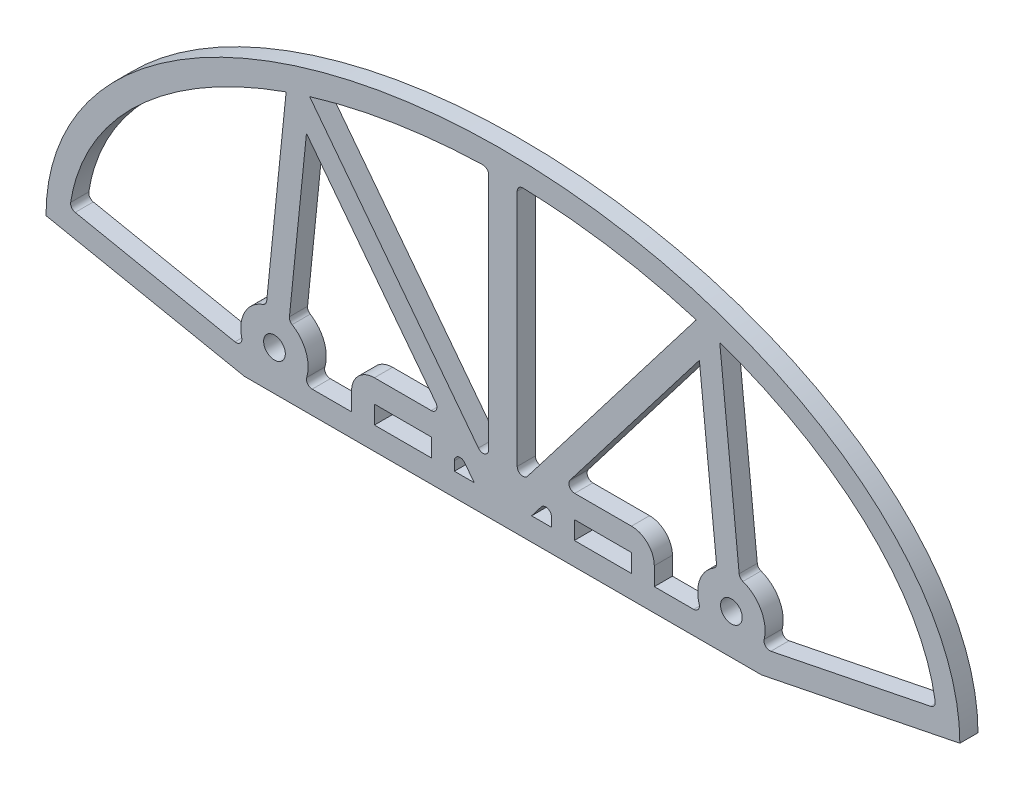
from build123d import *

# Parameters (mm, degrees)
SKETCH3_R           = 1.9
SKETCH3_W           = 10
SKETCH3_H           = 3.175
BOSS_EXTRUDE1_DEPTH = 3.175
CUT_EXTRUDE2_DEPTH  = 3.175
FILLET1_R           = 1


with BuildPart() as part:
    # Sketch3 → Boss-Extrude1 (new body)
    with BuildSketch(Plane.XY):
        with BuildLine():
            Line((-40, 22.2), (-5.265913382, 15.2))
            Line((-5.265913382, 15.2), (85.265913382, 15.2))
            Line((85.265913382, 15.2), (120, 22.2))
            add(Edge.make_bspline(
                [(120, 22.2), (120, 72.2), (40, 72.2), (-40, 72.2), (-40, 22.2)],
                knots=[3.141592654, 3.141592654, 3.141592654, 4.71238898, 4.71238898, 6.283185307, 6.283185307, 6.283185307], degree=2, weights=[1, 0.707106781, 1, 0.707106781, 1]))
        make_face()
        with Locations((80, 22.2)):
            Circle(SKETCH3_R, mode=Mode.SUBTRACT)
        with Locations((0, 22.2)):
            Circle(SKETCH3_R, mode=Mode.SUBTRACT)
        with Locations((57.5, 20.7875)):
            Rectangle(SKETCH3_W, SKETCH3_H, mode=Mode.SUBTRACT)
        with Locations((22.5, 20.7875)):
            Rectangle(SKETCH3_W, SKETCH3_H, mode=Mode.SUBTRACT)
    extrude(amount=BOSS_EXTRUDE1_DEPTH)

    # Sketch4 → Cut-Extrude2 (cut)
    with BuildSketch(Plane.XY.offset(3.175)):
        with BuildLine():
            add(Edge.make_bspline(
                [(2.040893372, 61.982357124), (2.034052922, 61.979946823), (-3.206137681, 60.132850009), (-11.950990438, 56.135783135), (-22.176984942, 48.964684289), (-29.333828942, 41.516537507), (-33.241172174, 34.903291209), (-35.119628904, 29.501109788), (-35.644509516, 26.807089313), (-35.807708322, 25.435543842)],
                knots=[5.225747329, 5.225747329, 5.225747329, 5.225747329, 5.226053967, 5.460671409, 5.647742016, 5.834812623, 6.02188323, 6.115418534, 6.208953837, 6.208953837, 6.208953837, 6.208953837], degree=3))
            Line((-35.807708322, 25.435543842), (-5.108836853, 19.248765342))
            ThreePointArc((-5.108836853, 19.248765342), (-5.431262295, 24.504645284), (-1.427364793, 27.9247384))
            Line((-1.427364793, 27.9247384), (2.040893372, 61.982357124))
        make_face()
        with BuildLine():
            Line((5.602787237, 57.477095609), (2.552054401, 27.51949418))
            ThreePointArc((2.552054401, 27.51949418), (5.645078526, 23.915543189), (5.080354318, 19.2))
            Line((5.080354318, 19.2), (13.5, 19.2))
            Line((13.5, 19.2), (13.5, 22.375))
            ThreePointArc((13.5, 22.375), (14.671572875, 25.203427125), (17.5, 26.375))
            Line((17.5, 26.375), (27.44436289, 26.375))
            ThreePointArc((27.44436289, 26.375), (28.341254025, 26.932748609), (28.237665594, 27.983827414))
            Line((28.237665594, 27.983827414), (5.602787237, 57.477095609))
        make_face()
        with BuildLine():
            Line((6.200353033, 63.345075177), (6.193466104, 63.27744687))
            Line((6.193466104, 63.27744687), (37.5, 22.485003195))
            Line((37.5, 22.485003195), (37.5, 68.174714181))
            add(Edge.make_bspline(
                [(37.5, 68.174714181), (35.918048143, 68.14270145), (27.100581574, 67.794472092), (16.458909718, 66.204615871), (8.008252178, 63.893967585), (6.204326194, 63.346281726), (6.200353033, 63.345075177)],
                knots=[4.744653076, 4.744653076, 4.744653076, 4.744653076, 4.805924284, 5.086530195, 5.164504381, 5.164676506, 5.164676506, 5.164676506, 5.164676506], degree=3))
        make_face()
        with BuildLine():
            Line((34.978894261, 19.2), (33.293302704, 21.396327414))
            ThreePointArc((33.293302704, 21.396327414), (32.178521155, 21.734416761), (31.5, 20.7875))
            Line((31.5, 20.7875), (31.5, 19.2))
            Line((31.5, 19.2), (34.978894261, 19.2))
        make_face()
        with BuildLine():
            add(Edge.make_bspline(
                [(73.799646967, 63.345075177), (73.795673806, 63.346281726), (71.991747822, 63.893967585), (63.541090282, 66.204615871), (52.899418426, 67.794472092), (44.081951857, 68.14270145), (42.5, 68.174714181)],
                knots=[4.260101454, 4.260101454, 4.260101454, 4.260101454, 4.26027358, 4.338247766, 4.618853677, 4.680124885, 4.680124885, 4.680124885, 4.680124885], degree=3))
            Line((42.5, 68.174714181), (42.5, 22.485003195))
            Line((42.5, 22.485003195), (73.806533896, 63.27744687))
            Line((73.806533896, 63.27744687), (73.799646967, 63.345075177))
        make_face()
        with BuildLine():
            Line((46.706697296, 21.396327414), (45.021105739, 19.2))
            Line((45.021105739, 19.2), (48.5, 19.2))
            Line((48.5, 19.2), (48.5, 20.7875))
            ThreePointArc((48.5, 20.7875), (47.821478845, 21.734416761), (46.706697296, 21.396327414))
        make_face()
        with BuildLine():
            Line((77.447945599, 27.51949418), (74.397212763, 57.477095609))
            Line((74.397212763, 57.477095609), (51.762334406, 27.983827414))
            ThreePointArc((51.762334406, 27.983827414), (51.658745975, 26.932748609), (52.55563711, 26.375))
            Line((52.55563711, 26.375), (62.5, 26.375))
            ThreePointArc((62.5, 26.375), (65.328427125, 25.203427125), (66.5, 22.375))
            Line((66.5, 22.375), (66.5, 19.2))
            Line((66.5, 19.2), (74.919645682, 19.2))
            ThreePointArc((74.919645682, 19.2), (74.354921474, 23.915543189), (77.447945599, 27.51949418))
        make_face()
        with BuildLine():
            add(Edge.make_bspline(
                [(115.807708322, 25.435543842), (115.644509516, 26.807089313), (115.119628904, 29.501109788), (113.241172174, 34.903291209), (109.333828942, 41.516537507), (102.176984942, 48.964684289), (91.950990438, 56.135783135), (83.206137681, 60.132850009), (77.965947078, 61.979946823), (77.959106628, 61.982357124)],
                knots=[3.215824123, 3.215824123, 3.215824123, 3.215824123, 3.309359427, 3.40289473, 3.589965338, 3.777035945, 3.964106552, 4.198723994, 4.199030631, 4.199030631, 4.199030631, 4.199030631], degree=3))
            Line((77.959106628, 61.982357124), (81.427364793, 27.9247384))
            ThreePointArc((81.427364793, 27.9247384), (85.431262295, 24.504645284), (85.108836853, 19.248765342))
            Line((85.108836853, 19.248765342), (115.807708322, 25.435543842))
        make_face()
    extrude(amount=-CUT_EXTRUDE2_DEPTH, mode=Mode.SUBTRACT)

    # Fillet1
    fillet1_edges = [part.edges().sort_by_distance(p)[0] for p in [
        (115.807708322, 25.435543842, 1.5875),
        (-35.807708322, 25.435543842, 1.5875),
        (-5.108836853, 19.248765342, 1.5875),
        (5.080354318, 19.2, 1.5875),
        (2.552054401, 27.51949418, 1.5875),
        (-1.427364793, 27.9247384, 1.5875),
        (37.5, 22.485003195, 1.5875),
        (37.5, 68.174714181, 1.5875),
        (42.5, 68.174714181, 1.5875),
        (42.5, 22.485003195, 1.5875),
        (85.108836853, 19.248765342, 1.5875),
        (81.427364793, 27.9247384, 1.5875),
        (74.919645682, 19.2, 1.5875),
        (77.447945599, 27.51949418, 1.5875),
    ]]
    fillet(fillet1_edges, radius=FILLET1_R)


solid = part.part
